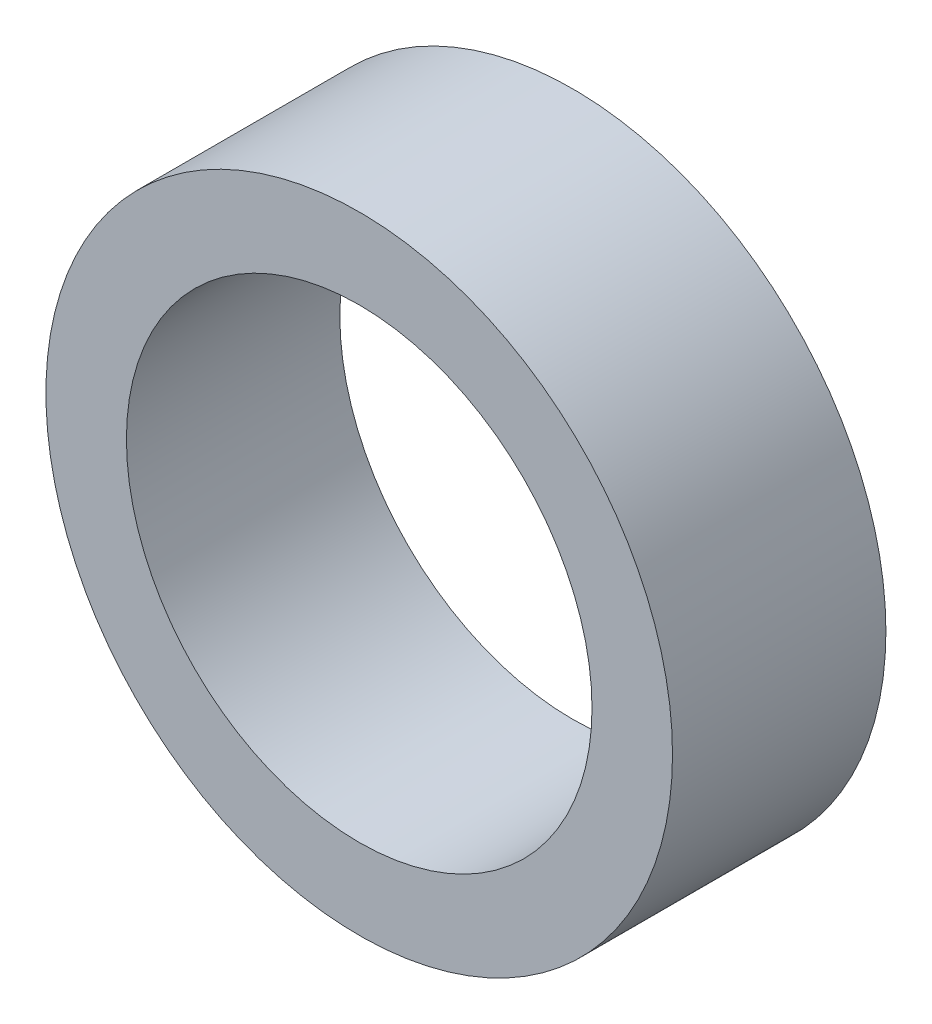
from build123d import *

# Parameters (mm, degrees)
SKETCH1_R           = 8.075
SKETCH1_R_2         = 6
BOSS_EXTRUDE1_DEPTH = 5.5


with BuildPart() as part:
    # Sketch1 → Boss-Extrude1 (new body)
    with BuildSketch(Plane.XY):
        Circle(SKETCH1_R)
        Circle(SKETCH1_R_2, mode=Mode.SUBTRACT)
    extrude(amount=BOSS_EXTRUDE1_DEPTH)


solid = part.part
